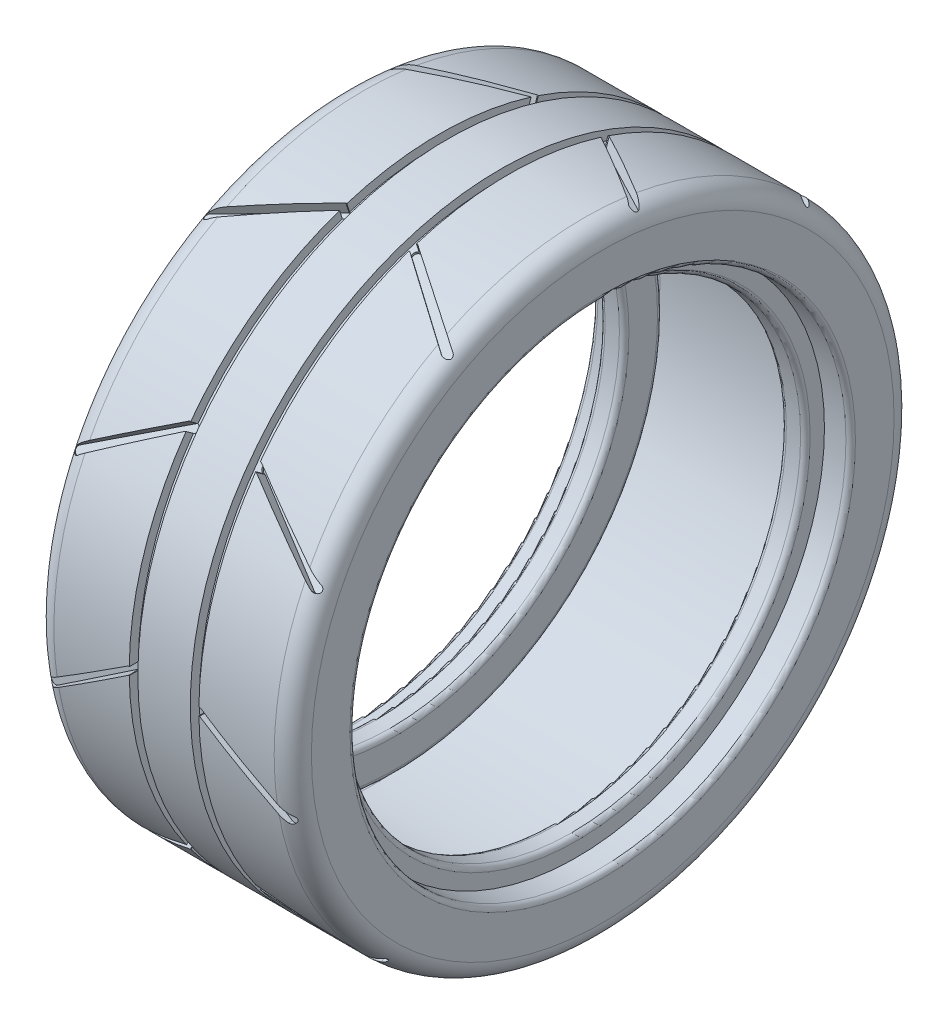
from build123d import *

# Parameters (mm, degrees)
CENTER_GROOVE_SECTIONS_W     = 0.9
CENTER_GROOVE_SECTIONS_H     = 2.45
SHOULDER_GROOVE_PAIR_DEPTH   = 73.906258437
CIRCULAR_TREAD_PATTERN_COUNT = 10


with BuildPart() as part:
    # Tire Cross Section → Tire Profile (revolve)
    with BuildSketch(Plane(origin=(0, 0, 0), x_dir=(1, 0, 0), z_dir=(0, 1, 0))):
        with BuildLine():
            Line((13.5, 32.5), (-13.5, 32.5))
            Line((-13.5, 32.5), (-13.5, 26.5))
            ThreePointArc((-13.5, 26.5), (-13.353553391, 26.146446609), (-13, 26))
            Line((-13, 26), (-10.75, 26))
            Line((-10.75, 26), (-10.75, 24.5))
            ThreePointArc((-10.75, 24.5), (-10.603553391, 24.146446609), (-10.25, 24))
            Line((-10.25, 24), (-8.75, 24))
            ThreePointArc((-8.75, 24), (-8.396446609, 24.146446609), (-8.25, 24.5))
            Line((-8.25, 24.5), (-8.25, 27.5))
            ThreePointArc((-8.25, 27.5), (-8.396446609, 27.853553391), (-8.75, 28))
            Line((-8.75, 28), (-11, 28))
            ThreePointArc((-11, 28), (-11.353553391, 28.146446609), (-11.5, 28.5))
            Line((-11.5, 28.5), (-11.5, 30))
            ThreePointArc((-11.5, 30), (-11.353553391, 30.353553391), (-11, 30.5))
            Line((-11, 30.5), (11, 30.5))
            ThreePointArc((11, 30.5), (11.353553391, 30.353553391), (11.5, 30))
            Line((11.5, 30), (11.5, 28.5))
            ThreePointArc((11.5, 28.5), (11.353553391, 28.146446609), (11, 28))
            Line((11, 28), (8.75, 28))
            ThreePointArc((8.75, 28), (8.396446609, 27.853553391), (8.25, 27.5))
            Line((8.25, 27.5), (8.25, 24.5))
            ThreePointArc((8.25, 24.5), (8.396446609, 24.146446609), (8.75, 24))
            Line((8.75, 24), (10.25, 24))
            ThreePointArc((10.25, 24), (10.603553391, 24.146446609), (10.75, 24.5))
            Line((10.75, 24.5), (10.75, 26))
            Line((10.75, 26), (13, 26))
            ThreePointArc((13, 26), (13.353553391, 26.146446609), (13.5, 26.5))
            Line((13.5, 26.5), (13.5, 32.5))
        make_face()
    revolve(axis=Axis((0, 0, 0), (-1, 0, 0)))

    # Shoulder Radius Sections → Rounded Shoulders (revolve, cut)
    with BuildSketch(Plane(origin=(0, 0, 0), x_dir=(1, 0, 0), z_dir=(0, 1, 0)), mode=Mode.PRIVATE) as rounded_shoulders_sk:
        with BuildLine():
            Line((-13.5, 30.55), (-13.9, 30.55))
            Line((-13.9, 30.55), (-13.9, 33.5))
            Line((-13.9, 33.5), (-11.55, 33.5))
            Line((-11.55, 33.5), (-11.55, 32.5))
            ThreePointArc((-11.55, 32.5), (-12.928858223, 31.928858223), (-13.5, 30.55))
        make_face()
        with BuildLine():
            Line((13.5, 30.55), (13.9, 30.55))
            Line((13.9, 30.55), (13.9, 33.5))
            Line((13.9, 33.5), (11.55, 33.5))
            Line((11.55, 33.5), (11.55, 32.5))
            ThreePointArc((11.55, 32.5), (12.928858223, 31.928858223), (13.5, 30.55))
        make_face()
    revolve(rounded_shoulders_sk.sketch.rotate(Axis((-14.85, 0, 0), (1, 0, 0)), 180), axis=Axis((-14.85, 0, 0), (1, 0, 0)), mode=Mode.SUBTRACT)

    # Center Groove Sections → Twin Center Grooves (revolve, cut)
    with BuildSketch(Plane(origin=(0, 0, 0), x_dir=(1, 0, 0), z_dir=(0, 1, 0)), mode=Mode.PRIVATE) as twin_center_grooves_sk:
        with Locations((-3.2, 32.775)):
            Rectangle(CENTER_GROOVE_SECTIONS_W, CENTER_GROOVE_SECTIONS_H)
        with Locations((3.2, 32.775)):
            Rectangle(CENTER_GROOVE_SECTIONS_W, CENTER_GROOVE_SECTIONS_H)
    revolve(twin_center_grooves_sk.sketch.rotate(Axis((-14.85, 0, 0), (1, 0, 0)), 180), axis=Axis((-14.85, 0, 0), (1, 0, 0)), mode=Mode.SUBTRACT)

    # Mirrored Shoulder Groove Profiles → Shoulder Groove Pair (cut, through all)
    with BuildSketch(Plane.XY.offset(31.35)):
        with BuildLine():
            Line((-3.72, -0.44), (-12.32, -6.22))
            ThreePointArc((-12.32, -6.22), (-12.86586257, -6.06390838), (-12.8, -5.5))
            Line((-12.8, -5.5), (-3.76, 0.39))
            ThreePointArc((-3.76, 0.39), (-3.350255679, -0.006217141), (-3.72, -0.44))
        make_face()
        with BuildLine():
            Line((3.72, -0.44), (12.32, -6.22))
            ThreePointArc((12.32, -6.22), (12.86586257, -6.06390838), (12.8, -5.5))
            Line((12.8, -5.5), (3.76, 0.39))
            ThreePointArc((3.76, 0.39), (3.350255679, -0.006217141), (3.72, -0.44))
        make_face()
    shoulder_groove_pair = extrude(amount=SHOULDER_GROOVE_PAIR_DEPTH, mode=Mode.SUBTRACT)

    # Circular Tread Pattern: Shoulder Groove Pair ×10 about axis
    circular_tread_pattern_axis = Axis((0, 0, 0), (1, 0, 0))
    for i in range(1, CIRCULAR_TREAD_PATTERN_COUNT):
        add(shoulder_groove_pair.rotate(circular_tread_pattern_axis, i * 360 / CIRCULAR_TREAD_PATTERN_COUNT), mode=Mode.SUBTRACT)


solid = part.part
